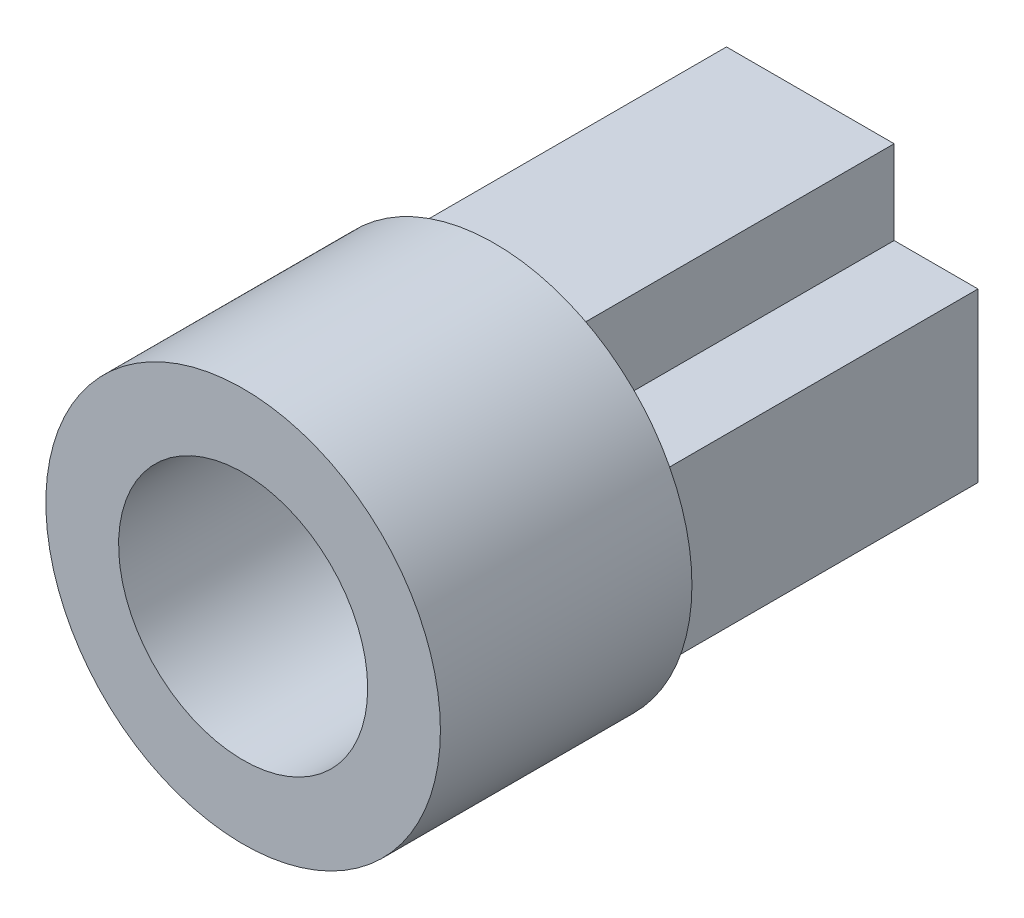
from build123d import *

# Parameters (mm, degrees)
SKETCH1_R           = 4
SKETCH1_R_2         = 2.525
BOSS_EXTRUDE1_DEPTH = 5.1
BOSS_EXTRUDE2_DEPTH = 6.4
SKETCH3_R           = 2.5
BOSS_EXTRUDE5_DEPTH = 1.1


with BuildPart() as part:
    # Sketch1 → Boss-Extrude1 (new body)
    with BuildSketch(Plane.XY):
        Circle(SKETCH1_R)
        Circle(SKETCH1_R_2, mode=Mode.SUBTRACT)
    extrude(amount=BOSS_EXTRUDE1_DEPTH)

    # Sketch2 → Boss-Extrude2 (add)
    with BuildSketch(Plane(origin=(0, 0, 0), x_dir=(-1, 0, 0), z_dir=(0, 0, -1))):
        Polygon((-1.7, 3.4), (-1.7, 1.7), (-3.4, 1.7), (-3.4, -1.7), (-1.7, -1.7), (-1.7, -3.4), (1.7, -3.4), (1.7, -1.7), (3.4, -1.7), (3.4, 1.7), (1.7, 1.7), (1.7, 3.4), align=None)
        with BuildLine():
            Line((-1.05, 2.45), (-1.05, 1.55))
            ThreePointArc((-1.05, 1.55), (-1.196446609, 1.196446609), (-1.55, 1.05))
            Line((-1.55, 1.05), (-2.45, 1.05))
            Line((-2.45, 1.05), (-2.45, -1.05))
            Line((-2.45, -1.05), (-1.55, -1.05))
            ThreePointArc((-1.55, -1.05), (-1.196446609, -1.196446609), (-1.05, -1.55))
            Line((-1.05, -1.55), (-1.05, -2.45))
            Line((-1.05, -2.45), (1.05, -2.45))
            Line((1.05, -2.45), (1.05, -1.55))
            ThreePointArc((1.05, -1.55), (1.196446609, -1.196446609), (1.55, -1.05))
            Line((1.55, -1.05), (2.45, -1.05))
            Line((2.45, -1.05), (2.45, 1.05))
            Line((2.45, 1.05), (1.55, 1.05))
            ThreePointArc((1.55, 1.05), (1.196446609, 1.196446609), (1.05, 1.55))
            Line((1.05, 1.55), (1.05, 2.45))
            Line((1.05, 2.45), (-1.05, 2.45))
        make_face(mode=Mode.SUBTRACT)
    extrude(amount=BOSS_EXTRUDE2_DEPTH)

    # Sketch3 → Boss-Extrude5 (add)
    with BuildSketch(Plane(origin=(0, 0, 0), x_dir=(-1, 0, 0), z_dir=(0, 0, -1))):
        Circle(SKETCH3_R)
        Polygon((-0.80736121, 2.151247078), (-0.80736121, 0.83443077), (-2.19666282, 0.83443077), (-2.19666282, -0.796488511), (-0.80736121, -0.796488511), (-0.80736121, -2.18579012), (0.78731542, -2.18579012), (0.78731542, -0.796488511), (2.152455262, -0.796488511), (2.152455262, 0.83443077), (0.78731542, 0.83443077), (0.78731542, 2.151247078), align=None, mode=Mode.SUBTRACT)
    extrude(amount=-BOSS_EXTRUDE5_DEPTH)


solid = part.part
